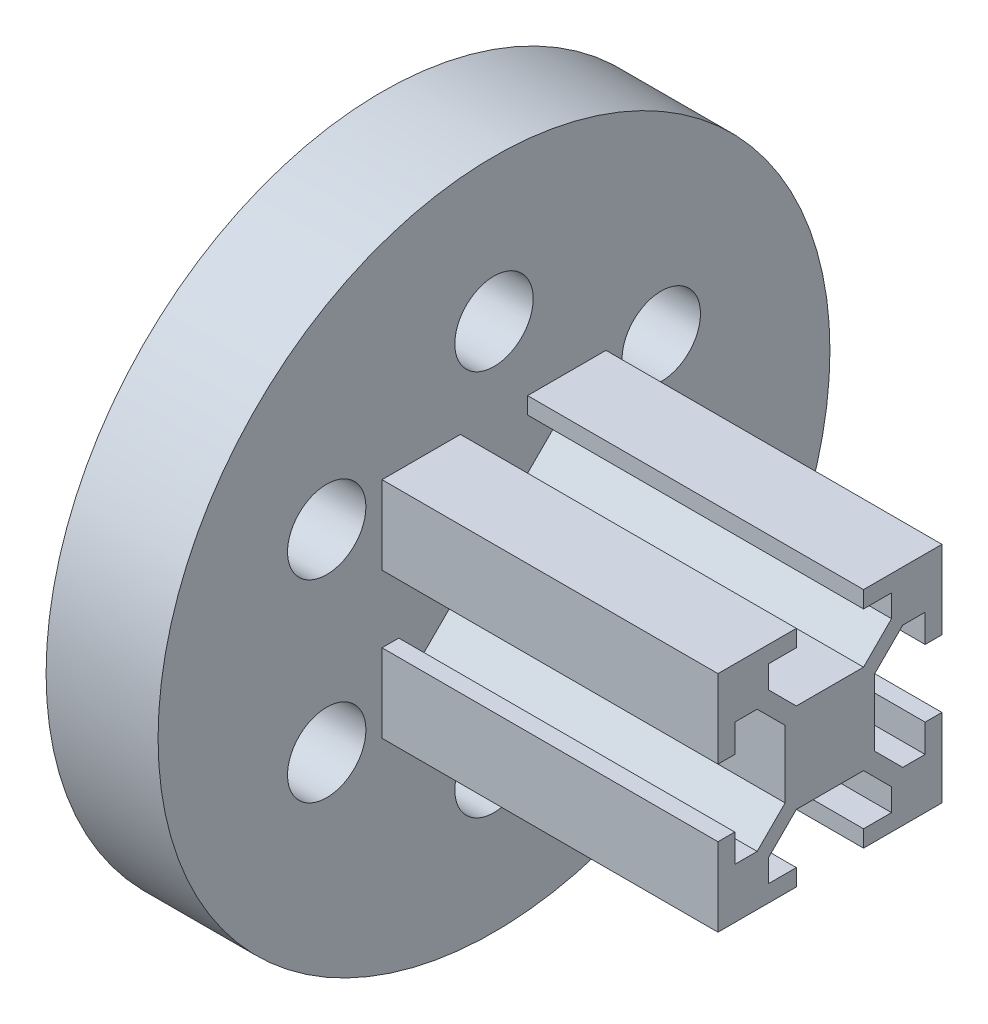
from build123d import *

# Parameters (mm, degrees)
SKETCH_1_R          = 30
EXTRUDE_1_DEPTH     = 5
SKETCH_2_W          = 20
SKETCH_2_H          = 20
EXTRUDE_2_DEPTH     = 30
EXTRUDE_START       = 5
SKETCH_4_R          = 30
EXTRUDE_3_DEPTH     = 5
CUT_EXTRUDE_1_DEPTH = 30
SKETCH_7_R          = 2.1
CUT_EXTRUDE_2_DEPTH = 30
SKETCH_8_R          = 3.5
CUT_EXTRUDE_3_DEPTH = 5


with BuildPart() as part:
    # 草图1 → 凸台-拉伸1 (new body)
    with BuildSketch(Plane(origin=(0, 0, 0), x_dir=(0, 0, -1), z_dir=(1, 0, 0))):
        Circle(SKETCH_1_R)
    extrude(amount=EXTRUDE_1_DEPTH)

    # 草图2 → 凸台-拉伸2 (add)
    with BuildSketch(Plane(origin=(5, 0, 0), x_dir=(0, 0, -1), z_dir=(1, 0, 0))):
        Rectangle(SKETCH_2_W, SKETCH_2_H)
    extrude(amount=EXTRUDE_2_DEPTH)

    # 草图4 → 凸台-拉伸3 (add)
    with BuildSketch(Plane.ZY.offset(EXTRUDE_START)):
        Circle(SKETCH_4_R)
    extrude(amount=-EXTRUDE_3_DEPTH)

    # 草图5 → 切除-拉伸1 (cut)
    with BuildSketch(Plane(origin=(35, 0, 0), x_dir=(0, 0, -1), z_dir=(1, 0, 0))):
        Polygon((-10, 3), (-10, 0), (-4, 0), (-4, 3), (-6.5, 5.5), (-8.5, 5.5), (-8.5, 3), align=None)
        Polygon((-4, 0), (-10, 0), (-10, -3), (-8.5, -3), (-8.5, -5.5), (-6.5, -5.5), (-4, -3), align=None)
        Polygon((-3, -8.5), (-3, -10), (3, -10), (3, -8.5), (5.5, -8.5), (5.5, -6.5), (3, -4), (-3, -4), (-5.5, -6.5), (-5.5, -8.5), align=None)
        Polygon((10, -3), (10, 3), (8.5, 3), (8.5, 5.5), (6.5, 5.5), (4, 3), (4, -3), (6.5, -5.5), (8.5, -5.5), (8.5, -3), align=None)
        Polygon((3, 10), (-3, 10), (-3, 8.5), (-5.5, 8.5), (-5.5, 6.5), (-3, 4), (3, 4), (5.5, 6.5), (5.5, 8.5), (3, 8.5), align=None)
    extrude(amount=-CUT_EXTRUDE_1_DEPTH, mode=Mode.SUBTRACT)

    # 草图7 → 切除-拉伸2 (cut)
    with BuildSketch(Plane.ZY.offset(5)):
        with Locations((0, -17.25)):
            Circle(SKETCH_7_R)
        with Locations((-14.938938215, -8.625)):
            Circle(SKETCH_7_R)
        with Locations((-14.938938215, 8.625)):
            Circle(SKETCH_7_R)
        with Locations((0, 17.25)):
            Circle(SKETCH_7_R)
        with Locations((14.938938215, 8.625)):
            Circle(SKETCH_7_R)
        with Locations((14.938938215, -8.625)):
            Circle(SKETCH_7_R)
    extrude(amount=-CUT_EXTRUDE_2_DEPTH, mode=Mode.SUBTRACT)

    # 草图8 → 切除-拉伸3 (cut)
    with BuildSketch(Plane(origin=(5, 0, 0), x_dir=(0, 0, -1), z_dir=(1, 0, 0))):
        with Locations((-14.938938215, 8.625)):
            Circle(SKETCH_8_R)
        with Locations((0, 17.25)):
            Circle(SKETCH_8_R)
        with Locations((14.938938215, 8.625)):
            Circle(SKETCH_8_R)
        with Locations((14.938938215, -8.625)):
            Circle(SKETCH_8_R)
        with Locations((0, -17.25)):
            Circle(SKETCH_8_R)
        with Locations((-14.938938215, -8.625)):
            Circle(SKETCH_8_R)
    extrude(amount=-CUT_EXTRUDE_3_DEPTH, mode=Mode.SUBTRACT)


solid = part.part
